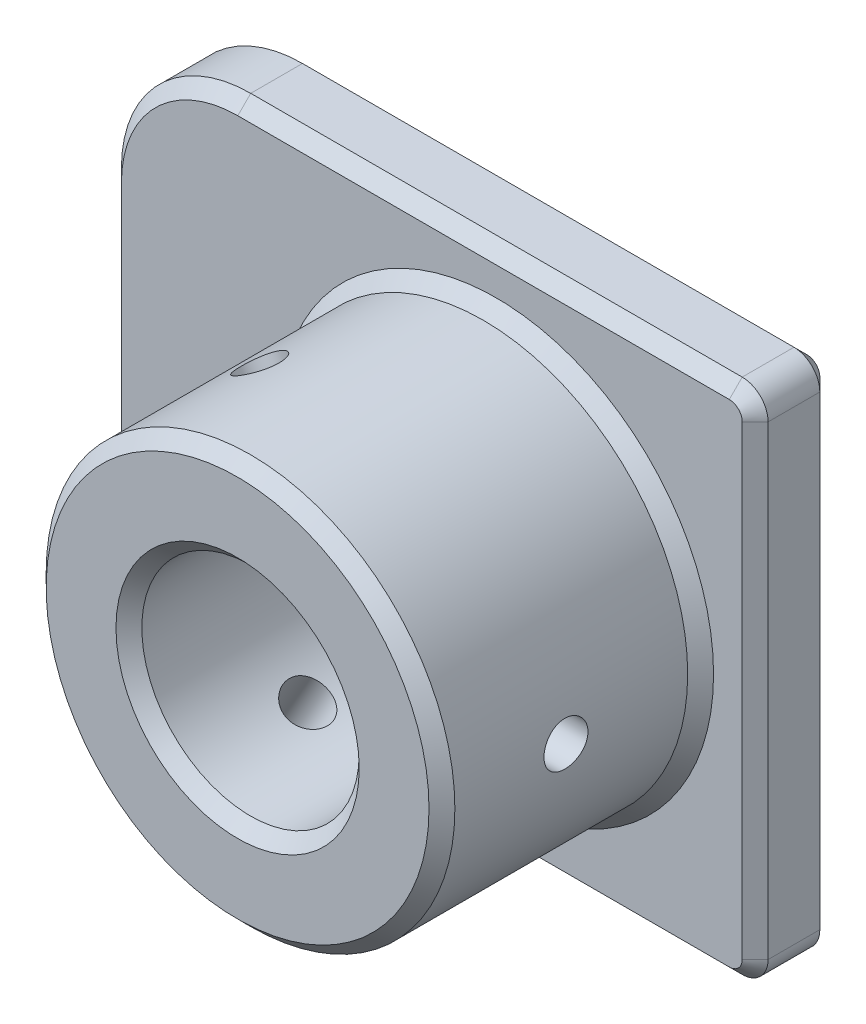
from build123d import *

# Parameters (mm, degrees)
SKETCH1_R                      = 0.005
BOSS_EXTRUDE1_DEPTH            = 0.003
SKETCH2_R                      = 0.0079
SKETCH2_R_2                    = 0.004201919
BOSS_EXTRUDE3_DEPTH            = 0.01
CHAMFER1_SIZE                  = 0.0005
CUT_EXTRUDE1_REACH             = 2.054
SKETCH3_R                      = 0.00085
CUT_EXTRUDE1_DIRECTION_2_DEPTH = 1.053763073
CIRPATTERN1_COUNT              = 3
SCALE1_SCALE                   = 1000


with BuildPart() as part:
    # Sketch1 → Boss-Extrude1 (new body)
    with BuildSketch(Plane.XY):
        with BuildLine():
            Line((0.009008368, -0.025787204), (-0.009991632, -0.025787204))
            ThreePointArc((-0.009991632, -0.025787204), (-0.013527166, -0.02725167), (-0.014991632, -0.030787204))
            Line((-0.014991632, -0.030787204), (-0.014991632, -0.040787204))
            ThreePointArc((-0.014991632, -0.040787204), (-0.013527166, -0.044322738), (-0.009991632, -0.045787204))
            Line((-0.009991632, -0.045787204), (0.009008368, -0.045787204))
            ThreePointArc((0.009008368, -0.045787204), (0.009715474, -0.045494311), (0.010008368, -0.044787204))
            Line((0.010008368, -0.044787204), (0.010008368, -0.026787204))
            ThreePointArc((0.010008368, -0.026787204), (0.009715474, -0.026080097), (0.009008368, -0.025787204))
        make_face()
        with Locations((0, -0.035787204)):
            Circle(SKETCH1_R, mode=Mode.SUBTRACT)
    extrude(amount=BOSS_EXTRUDE1_DEPTH)

    # Sketch2 → Boss-Extrude3 (add)
    with BuildSketch(Plane.XY.offset(0.003)):
        with Locations((0, -0.035787204)):
            Circle(SKETCH2_R)
        with Locations((0, -0.035787204)):
            Circle(SKETCH2_R_2, mode=Mode.SUBTRACT)
    extrude(amount=BOSS_EXTRUDE3_DEPTH)

    # Chamfer1
    chamfer1_edges = [part.edges().sort_by_distance(p)[0] for p in [
        (-0.000491632, -0.045787204, 0),
        (-0.013527166, -0.044322738, 0),
        (-0.014991632, -0.035787204, 0),
        (0.009715474, -0.045494311, 0.003),
        (-0.013527166, -0.02725167, 0),
        (-0.000491632, -0.025787204, 0),
        (0.009715474, -0.026080097, 0),
        (0.010008368, -0.035787204, 0),
        (0.009715474, -0.045494311, 0),
        (-0.005, -0.035787204, 0),
        (0.010008368, -0.035787204, 0.003),
        (0.009715474, -0.026080097, 0.003),
        (-0.000491632, -0.025787204, 0.003),
        (-0.0079, -0.035787204, 0.003),
        (-0.013527166, -0.02725167, 0.003),
        (-0.0079, -0.035787204, 0.013),
        (-0.004201919, -0.035787204, 0.013),
        (-0.014991632, -0.035787204, 0.003),
        (-0.013527166, -0.044322738, 0.003),
        (-0.000491632, -0.045787204, 0.003),
    ]]
    chamfer(chamfer1_edges, length=CHAMFER1_SIZE)

    # Sketch3 → Cut-Extrude1 (cut, up to next)
    with BuildSketch(Plane(origin=(0.010008368, 0, 0), x_dir=(0, 0, -1), z_dir=(1, 0, 0)), mode=Mode.PRIVATE) as cut_extrude1_sk1:
        with Locations(Location((-0.008204866, -0.035787204, 0), (0, 0, 90))):
            Circle(SKETCH3_R)
    cut_extrude1_tool1 = extrude(cut_extrude1_sk1.sketch, amount=-CUT_EXTRUDE1_REACH, mode=Mode.PRIVATE) & part.part
    cut_extrude1 = cut_extrude1_tool1.solids().sort_by_distance((0.010008, -0.035787, 0.008205))[0]
    add(cut_extrude1, mode=Mode.SUBTRACT)

    # Sketch3 → Cut-Extrude1 direction 2 (cut)
    with BuildSketch(Plane(origin=(0.010008368, 0, 0), x_dir=(0, 0, -1), z_dir=(1, 0, 0))):
        with Locations(Location((-0.008204866, -0.035787204, 0), (0, 0, 90))):
            Circle(SKETCH3_R)
    cut_extrude1_direction_2 = extrude(amount=CUT_EXTRUDE1_DIRECTION_2_DEPTH, mode=Mode.SUBTRACT)

    # CirPattern1: Cut-Extrude1, Cut-Extrude1 direction 2 ×3 about axis
    cirpattern1_axis = Axis((0, -0.035787204, 0.0125), (0, 0, 1))
    add([cut_extrude1.rotate(cirpattern1_axis, i * 360 / CIRPATTERN1_COUNT) for i in range(1, CIRPATTERN1_COUNT)], mode=Mode.SUBTRACT)
    add([cut_extrude1_direction_2.rotate(cirpattern1_axis, i * 360 / CIRPATTERN1_COUNT) for i in range(1, CIRPATTERN1_COUNT)], mode=Mode.SUBTRACT)


with BuildPart() as part_1:
    # Scale1: scaled about (-0.001262886, -0.035787205, 0.004936409)
    add(part.part.scale(SCALE1_SCALE).moved(Location((1.261623114, 35.751417795, -4.931472591))))


solid = part_1.part
